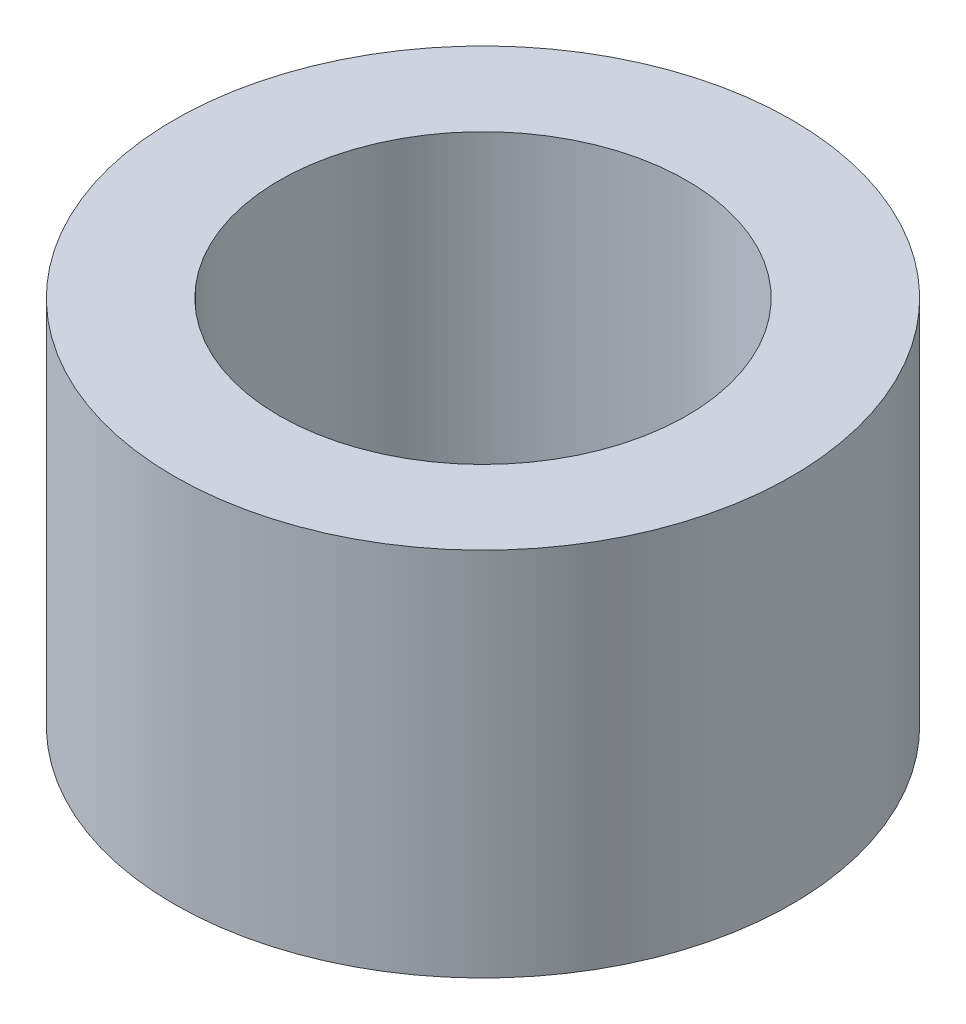
from build123d import *

# Parameters (mm, degrees)
SKETCH_1_R      = 2.5
SKETCH_1_R_2    = 1.65
EXTRUDE_1_DEPTH = 3


with BuildPart() as part:
    # 草图1 → 凸台-拉伸1 (new body)
    with BuildSketch(Plane(origin=(0, 0, 0), x_dir=(1, 0, 0), z_dir=(0, 1, 0))):
        with Locations(Location((0, 0, 0), (0, 0, 270))):
            Circle(SKETCH_1_R)
        with Locations(Location((0, 0, 0), (0, 0, 270))):
            Circle(SKETCH_1_R_2, mode=Mode.SUBTRACT)
    extrude(amount=EXTRUDE_1_DEPTH)


solid = part.part
